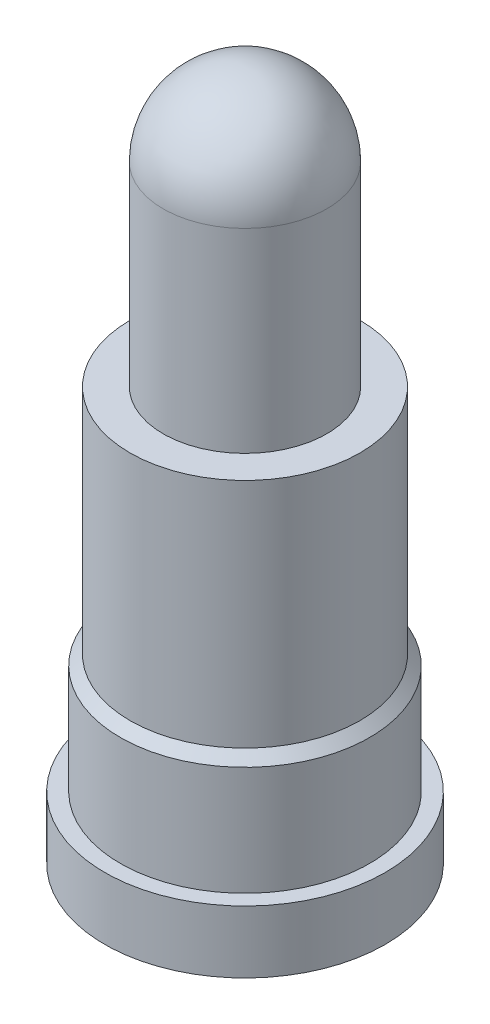
from build123d import *


with BuildPart() as part:
    # Sketch3 → Revolve1 (revolve)
    with BuildSketch(Plane.XY):
        with BuildLine():
            Line((-0.5334, 3.9624), (0, 3.9624))
            Line((0, 3.9624), (0, 4.4958))
            ThreePointArc((0, 4.4958), (-0.377170757, 4.339570757), (-0.5334, 3.9624))
        make_face()
        with BuildLine():
            ThreePointArc((-0.5334, 3.9624), (-0.377170757, 3.585229243), (0, 3.429))
            Line((0, 3.429), (0, 3.9624))
            Line((0, 3.9624), (-0.5334, 3.9624))
        make_face()
        with BuildLine():
            Line((-0.8128, 1.1176), (0, 1.1176))
            Line((0, 1.1176), (0, 3.429))
            ThreePointArc((0, 3.429), (-0.377170757, 3.585229243), (-0.5334, 3.9624))
            Line((-0.5334, 3.9624), (-0.5334, 2.6924))
            Line((-0.5334, 2.6924), (-0.7493, 2.6924))
            Line((-0.7493, 2.6924), (-0.7493, 1.1811))
            Line((-0.7493, 1.1811), (-0.8128, 1.1176))
        make_face()
        Polygon((-0.9144, 0), (0, 0), (0, 1.1176), (-0.8128, 1.1176), (-0.8128, 0.4064), (-0.9144, 0.4064), align=None)
    revolve(axis=Axis((0, 3.9624, 0), (0, -1, 0)))


solid = part.part
